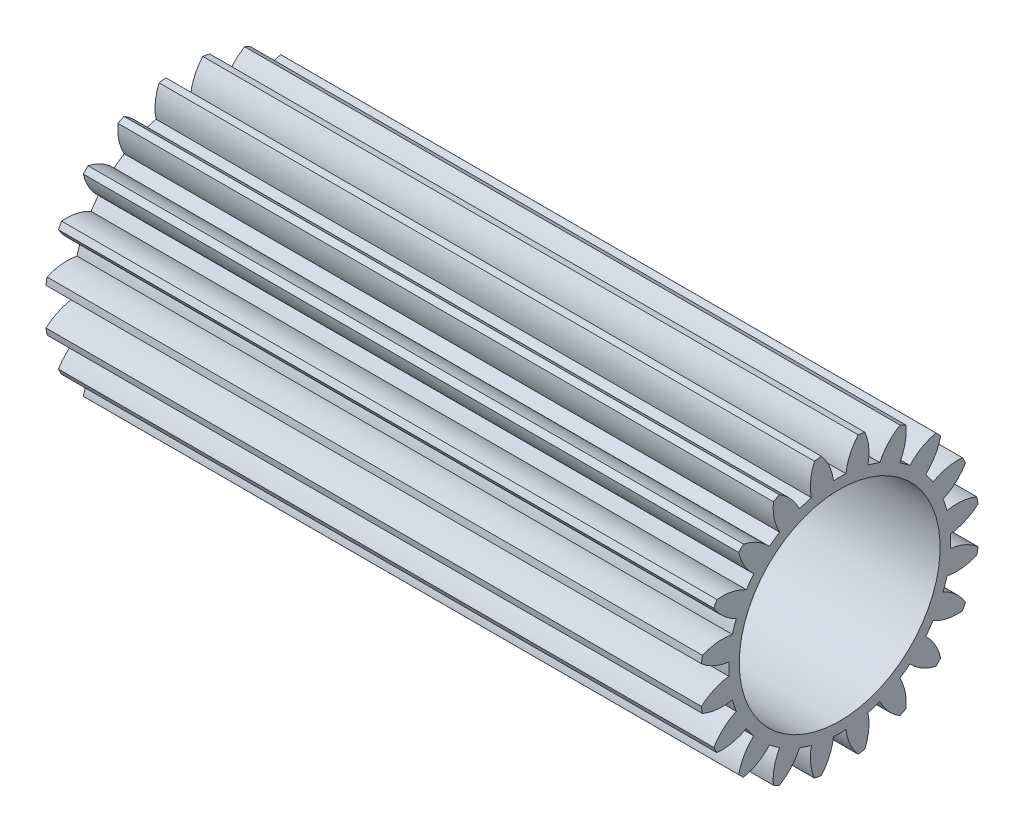
from build123d import *

# Parameters (mm, degrees)
BASPROSKE_W     = 15.5
BASPROSKE_H     = 3.3
TOOTHCUT_DEPTH  = 17.187340733
TEETHCUTS_COUNT = 20
TEETHCUTS_ANGLE = 342
BORSKE_R        = 2.375
BORE_DEPTH      = 50.0000508


with BuildPart() as part:
    # BasProSke → Base-Revolve (revolve)
    with BuildSketch(Plane(origin=(0, 0, 0), x_dir=(1, 0, 0), z_dir=(0, 1, 0)), mode=Mode.PRIVATE) as base_revolve_sk:
        with Locations((7.75, 1.65)):
            Rectangle(BASPROSKE_W, BASPROSKE_H)
    revolve(base_revolve_sk.sketch.rotate(Axis((-10, 0, 0), (1, 0, 0)), 180), axis=Axis((-10, 0, 0), (1, 0, 0)))

    # TooCutSke → ToothCut (cut, through all)
    with BuildSketch(Plane(origin=(0, 0, 0), x_dir=(0, 0, -1), z_dir=(1, 0, 0))):
        with BuildLine():
            ThreePointArc((0.147749882, 2.619837013), (0, 2.624), (-0.147749882, 2.619837013))
            ThreePointArc((-0.147749882, 2.619837013), (-0.249164975, 2.981336943), (-0.457329588, 3.293802485))
            ThreePointArc((-0.457329588, 3.293802485), (0, 3.3254), (0.457329588, 3.293802485))
            ThreePointArc((0.457329588, 3.293802485), (0.249164975, 2.981336943), (0.147749882, 2.619837013))
        make_face()
    toothcut = extrude(amount=TOOTHCUT_DEPTH, mode=Mode.SUBTRACT)

    # TeethCuts: ToothCut ×20 about axis
    teethcuts_axis = Axis((-10, 0, 0), (1, 0, 0))
    for i in range(1, TEETHCUTS_COUNT):
        add(toothcut.rotate(teethcuts_axis, i * TEETHCUTS_ANGLE / (TEETHCUTS_COUNT - 1)), mode=Mode.SUBTRACT)

    # BorSke → Bore (cut, symmetric)
    with BuildSketch(Plane(origin=(0, 0, 0), x_dir=(0, 0, -1), z_dir=(1, 0, 0))):
        with Locations(Location((0, 0, 0), (0, 0, 180))):
            Circle(BORSKE_R)
    extrude(amount=BORE_DEPTH, both=True, mode=Mode.SUBTRACT)


solid = part.part
